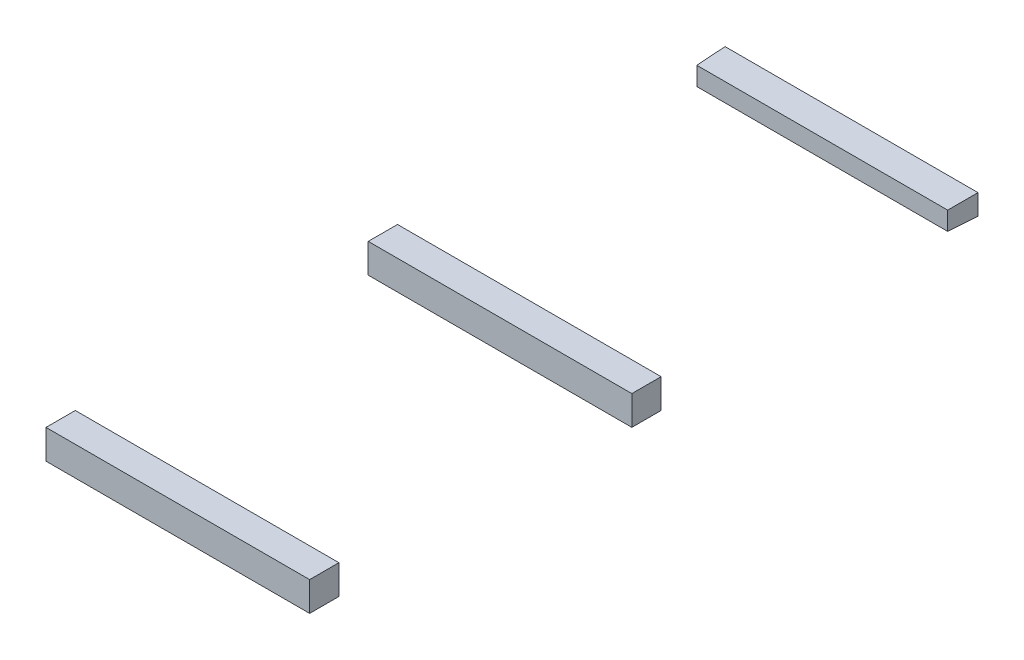
from build123d import *

# Parameters (mm, degrees)
SKETCH1_W             = 86.35
SKETCH1_H             = 7
BOSS_EXTRUDE1_DEPTH   = 10
BOSS_EXTRUDE1_TAPER   = 2
SKETCH2_W             = 10
SKETCH2_H             = 10
BOSS_EXTRUDE2_DEPTH   = 45
BOSS_EXTRUDE2_2_DEPTH = 45


with BuildPart() as part:
    # Sketch1 → Boss-Extrude1 (new body)
    with BuildSketch(Plane.XY):
        with Locations((0, -3.5)):
            Rectangle(SKETCH1_W, SKETCH1_H)
    extrude(amount=BOSS_EXTRUDE1_DEPTH, taper=BOSS_EXTRUDE1_TAPER)


with BuildPart() as body_2:
    # Sketch2 → Boss-Extrude2 (new, symmetric)
    with BuildSketch(Plane(origin=(0, 0, 0), x_dir=(0, 0, -1), z_dir=(1, 0, 0))):
        with Locations((-115, -3.5)):
            Rectangle(SKETCH2_W, SKETCH2_H)
    extrude(amount=BOSS_EXTRUDE2_DEPTH, both=True)


with BuildPart() as body_3:
    # Sketch2 → Boss-Extrude2 2 (new, symmetric)
    with BuildSketch(Plane(origin=(0, 0, 0), x_dir=(0, 0, -1), z_dir=(1, 0, 0))):
        with Locations((-225, -3.5)):
            Rectangle(SKETCH2_W, SKETCH2_H)
    extrude(amount=BOSS_EXTRUDE2_2_DEPTH, both=True)


solid = Compound([part.part, body_2.part, body_3.part])
